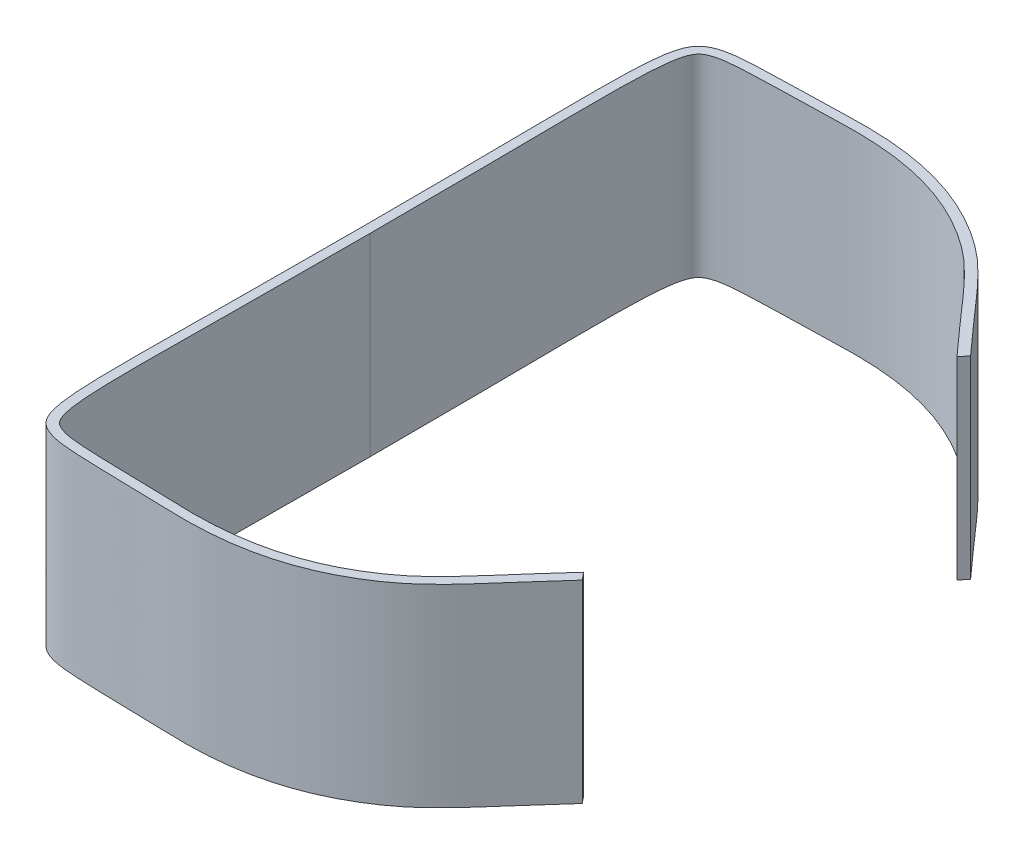
from build123d import *

# Parameters (mm, degrees)
BOSS_EXTRUDE1_DEPTH = 40.5
SKETCH2_R           = 63.5
CUT_EXTRUDE1_DEPTH  = 149.001762227


with BuildPart() as part:
    # Sketch1 → Boss-Extrude1 (new body)
    with BuildSketch(Plane(origin=(0, 0, 0), x_dir=(1, 0, 0), z_dir=(0, 1, 0))):
        with BuildLine():
            ThreePointArc((31.349721131, -40.069266737), (46.349721131, -25.069266737), (31.349721131, -10.069266737))
            add(Edge.make_bspline(
                [(31.349721131, -10.069266737), (5.290055017, -10.069266737), (7.051301627, -8.193060488), (-19.658840999, 16.912257573), (-29.939845637, 30.875468673), (-48.603400024, 44.622816299), (-63.666041029, 46.646988871), (-79.469262306, 45.935964516), (-95.172272758, 45.80483344), (-106.793117412, 43.148668762), (-104.500278869, 36.081837422), (-104.500278869, -25.069266737)],
                knots=[0, 0, 0, 0, 0.141137685, 0.170317061, 0.278296352, 0.317035273, 0.518967354, 0.554462651, 0.636492949, 0.682072063, 1, 1, 1, 1], degree=3))
            add(Edge.make_bspline(
                [(-104.500278869, -25.069266737), (-104.500278869, -86.220370896), (-106.793117412, -93.287202236), (-95.172272758, -95.943366915), (-79.469262306, -96.07449799), (-63.666041029, -96.785522346), (-48.603400024, -94.761349773), (-29.939845637, -81.014002148), (-19.658840999, -67.050791047), (7.051301627, -41.945472987), (5.290055017, -40.069266737), (31.349721131, -40.069266737)],
                knots=[0, 0, 0, 0, 0.317927937, 0.363507051, 0.445537349, 0.481032646, 0.682964727, 0.721703648, 0.829682939, 0.858862315, 1, 1, 1, 1], degree=3))
        make_face()
        with BuildLine():
            ThreePointArc((31.349721131, -38.069266737), (44.349721131, -25.069266737), (31.349721131, -12.069266737))
            add(Edge.make_bspline(
                [(31.349721131, -12.069266737), (30.646771854, -12.069266737), (29.211453194, -12.066877778), (27.23501585, -12.055126172), (25.357379573, -12.034195328), (23.004057135, -11.992677442), (20.318523924, -11.912663093), (17.465111976, -11.762941179), (14.934860365, -11.55006266), (11.932759317, -11.16764356), (8.763399773, -10.475131626), (5.59385852, -9.188323622), (2.881502653, -7.410660524), (0.395728614, -5.205925886), (-2.232105713, -2.547568098), (-5.356675639, 0.645706558), (-9.412468163, 4.537544856), (-13.760920495, 8.757850024), (-17.686786151, 12.850925113), (-21.25944417, 16.771778163), (-25.609260402, 21.708777219), (-30.404314067, 27.234763748), (-35.450976103, 32.402322376), (-40.234966673, 35.970242221), (-45.095688209, 38.790800573), (-49.938231137, 40.920449936), (-54.771139086, 42.453561133), (-59.576125902, 43.470033453), (-63.545114622, 43.953257707), (-66.69014633, 44.160731545), (-69.030285496, 44.236515953), (-71.353382372, 44.242783805), (-73.640916917, 44.187810155), (-76.132191277, 44.097405644), (-79.148793754, 44.011604675), (-82.631129764, 43.940427292), (-86.276832008, 43.863905954), (-89.829005855, 43.768890618), (-93.024827018, 43.640829485), (-95.538303237, 43.467627657), (-97.20670485, 43.245185064), (-98.295004719, 42.998016735), (-99.166056756, 42.703827909), (-99.864174161, 42.389474862), (-100.367662009, 42.05975972), (-100.764802454, 41.682240989), (-101.254364748, 40.99912672), (-101.853156268, 39.516631917), (-102.383736171, 36.327789636), (-102.679368897, 31.568606119), (-102.783388859, 25.012467856), (-102.758141913, 17.837666563), (-102.701925385, 10.933238419), (-102.649578735, 5.13734486), (-102.594900901, -1.31172538), (-102.553939485, -7.259869531), (-102.527860162, -12.381263523), (-102.512627236, -16.406898698), (-102.504356561, -19.923805889), (-102.500884757, -22.826507541), (-102.500278869, -24.32566409), (-102.500278869, -25.069266737)],
                knots=[0, 0, 0, 0, 0.00390625, 0.0078125, 0.01171875, 0.015625, 0.0234375, 0.03125, 0.0390625, 0.046875, 0.0625, 0.078125, 0.09375, 0.109375, 0.125, 0.140625, 0.15625, 0.171875, 0.1875, 0.203125, 0.21875, 0.25, 0.28125, 0.3125, 0.34375, 0.375, 0.40625, 0.4375, 0.46875, 0.484375, 0.5, 0.515625, 0.53125, 0.546875, 0.5625, 0.578125, 0.59375, 0.609375, 0.625, 0.640625, 0.65625, 0.671875, 0.6875, 0.703125, 0.71875, 0.734375, 0.75, 0.78125, 0.8125, 0.84375, 0.875, 0.90625, 0.921875, 0.9375, 0.953125, 0.96875, 0.9765625, 0.984375, 0.9921875, 0.99609375, 1, 1, 1, 1], degree=3))
            add(Edge.make_bspline(
                [(-102.500278869, -25.069266737), (-102.500278869, -25.812869385), (-102.500884757, -27.312025933), (-102.504356561, -30.214727586), (-102.512627236, -33.731634776), (-102.527860162, -37.757269951), (-102.553939485, -42.878663943), (-102.594900901, -48.826808094), (-102.649578735, -55.275878335), (-102.701925385, -61.071771893), (-102.758141913, -67.976200038), (-102.783388859, -75.151001331), (-102.679368897, -81.707139594), (-102.383736171, -86.46632311), (-101.853156268, -89.655165391), (-101.254364748, -91.137660195), (-100.764802454, -91.820774463), (-100.367662009, -92.198293194), (-99.864174161, -92.528008336), (-99.166056756, -92.842361383), (-98.295004719, -93.13655021), (-97.20670485, -93.383718539), (-95.538303237, -93.606161132), (-93.024827018, -93.77936296), (-89.829005855, -93.907424092), (-86.276832008, -94.002439428), (-82.631129764, -94.078960767), (-79.148793754, -94.150138149), (-76.132191277, -94.235939119), (-73.640916917, -94.326343629), (-71.353382372, -94.38131728), (-69.030285496, -94.375049427), (-66.69014633, -94.299265019), (-63.545114622, -94.091791182), (-59.576125902, -93.608566927), (-54.771139086, -92.592094607), (-49.938231137, -91.058983411), (-45.095688209, -88.929334048), (-40.234966673, -86.108775695), (-35.450976103, -82.540855851), (-30.404314067, -77.373297223), (-25.609260402, -71.847310693), (-21.25944417, -66.910311637), (-17.686786151, -62.989458587), (-13.760920495, -58.896383499), (-9.412468163, -54.67607833), (-5.356675639, -50.784240033), (-2.232105713, -47.590965377), (0.395728614, -44.932607588), (2.881502653, -42.72787295), (5.59385852, -40.950209853), (8.763399773, -39.663401848), (11.932759317, -38.970889915), (14.934860365, -38.588470814), (17.465111976, -38.375592295), (20.318523924, -38.225870381), (23.004057135, -38.145856033), (25.357379573, -38.104338147), (27.23501585, -38.083407303), (29.211453194, -38.071655697), (30.646771854, -38.069266737), (31.349721131, -38.069266737)],
                knots=[0, 0, 0, 0, 0.00390625, 0.0078125, 0.015625, 0.0234375, 0.03125, 0.046875, 0.0625, 0.078125, 0.09375, 0.125, 0.15625, 0.1875, 0.21875, 0.25, 0.265625, 0.28125, 0.296875, 0.3125, 0.328125, 0.34375, 0.359375, 0.375, 0.390625, 0.40625, 0.421875, 0.4375, 0.453125, 0.46875, 0.484375, 0.5, 0.515625, 0.53125, 0.5625, 0.59375, 0.625, 0.65625, 0.6875, 0.71875, 0.75, 0.78125, 0.796875, 0.8125, 0.828125, 0.84375, 0.859375, 0.875, 0.890625, 0.90625, 0.921875, 0.9375, 0.953125, 0.9609375, 0.96875, 0.9765625, 0.984375, 0.98828125, 0.9921875, 0.99609375, 1, 1, 1, 1], degree=3))
        make_face(mode=Mode.SUBTRACT)
    extrude(amount=BOSS_EXTRUDE1_DEPTH)

    # Sketch2 → Cut-Extrude1 (cut, through all)
    with BuildSketch(Plane(origin=(0, 40.5, 0), x_dir=(1, 0, 0), z_dir=(0, 1, 0))):
        with Locations((31.349721131, -25.069266737)):
            Circle(SKETCH2_R)
    extrude(amount=-CUT_EXTRUDE1_DEPTH, mode=Mode.SUBTRACT)


solid = part.part
